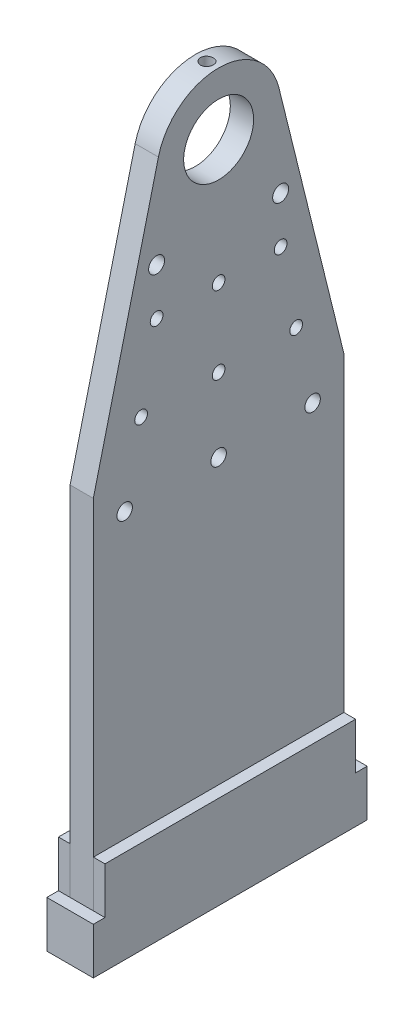
from build123d import *

# Parameters (mm, degrees)
SKETCH2_R               = 14.3129
SKETCH2_R_2             = 3.175
SKETCH2_R_3             = 2.6035
SKETCH2_R_4             = 3.2639
BOSS_EXTRUDE1_DEPTH     = 9.525
CHAMFER1_SIZE           = 4.7625
SKETCH3_R               = 2.6035
CUT_EXTRUDE1_DEPTH      = 25.4
CUT_EXTRUDE2_REACH      = 290.278
CUT_EXTRUDE2_END_RADIUS = 14.3129
SKETCH4_R               = 2.6035
SKETCH5_W               = 19.05
SKETCH5_H               = 112.128301604
SKETCH5_R               = 2.6035
BOSS_EXTRUDE2_DEPTH     = 12.7
SKETCH5_3_W             = 4.7625
SKETCH5_3_H             = 102.603301604
BOSS_EXTRUDE3_DEPTH     = 25.4
SKETCH5_4_W             = 19.05
SKETCH5_4_H             = 4.7625
BOSS_EXTRUDE4_DEPTH     = 6.35


with BuildPart() as part:
    # Sketch2 → Boss-Extrude1 (new body)
    with BuildSketch(Plane(origin=(-47.625, 0, 0), x_dir=(0, 0, -1), z_dir=(1, 0, 0))):
        with BuildLine():
            Line((51.301650802, 73.15), (51.301650802, 85.85))
            Line((51.301650802, 85.85), (24.65662816, 193.550056376))
            ThreePointArc((24.65662816, 193.550056376), (0, 212.85), (-24.65662816, 193.550056376))
            Line((-24.65662816, 193.550056376), (-51.301650802, 85.85))
            Line((-51.301650802, 85.85), (-51.301650802, 73.15))
            Line((-51.301650802, 73.15), (-51.301650802, -66.8))
            Line((-51.301650802, -66.8), (51.301650802, -66.8))
            Line((51.301650802, -66.8), (51.301650802, 73.15))
        make_face()
        with Locations((0, 187.45)):
            Circle(SKETCH2_R, mode=Mode.SUBTRACT)
        with Locations((38.476238101, 74.7375)):
            Circle(SKETCH2_R_2, mode=Mode.SUBTRACT)
        with Locations((0, 74.7375)):
            Circle(SKETCH2_R_2, mode=Mode.SUBTRACT)
        with Locations((-38.476238101, 74.7375)):
            Circle(SKETCH2_R_2, mode=Mode.SUBTRACT)
        with Locations((0, 136.65)):
            Circle(SKETCH2_R_3, mode=Mode.SUBTRACT)
        with Locations((-25.4, 136.65)):
            Circle(SKETCH2_R_3, mode=Mode.SUBTRACT)
        with Locations((-31.75, 104.9)):
            Circle(SKETCH2_R_3, mode=Mode.SUBTRACT)
        with Locations((0, 104.9)):
            Circle(SKETCH2_R_3, mode=Mode.SUBTRACT)
        with Locations((31.75, 104.9)):
            Circle(SKETCH2_R_3, mode=Mode.SUBTRACT)
        with Locations((25.4, 136.65)):
            Circle(SKETCH2_R_3, mode=Mode.SUBTRACT)
        with Locations((-25.4, 155.7)):
            Circle(SKETCH2_R_4, mode=Mode.SUBTRACT)
        with Locations((25.4, 155.7)):
            Circle(SKETCH2_R_4, mode=Mode.SUBTRACT)
    extrude(amount=BOSS_EXTRUDE1_DEPTH)

    # Chamfer1
    chamfer1_edges = [part.edges().sort_by_distance(p)[0] for p in [
        (-47.625, 74.7375, 3.175),
        (-47.625, 74.7375, -35.301238101),
        (-47.625, 74.7375, 41.651238101),
    ]]
    chamfer(chamfer1_edges, length=CHAMFER1_SIZE)

    # Sketch3 → Cut-Extrude1 (cut)
    with BuildSketch(Plane.XZ.offset(66.8)):
        with Locations((-42.8625, -38.476238101)):
            Circle(SKETCH3_R)
        with Locations((-42.8625, 0)):
            Circle(SKETCH3_R)
        with Locations((-42.8625, 38.476238101)):
            Circle(SKETCH3_R)
    extrude(amount=-CUT_EXTRUDE1_DEPTH, mode=Mode.SUBTRACT)

    # Cut-Extrude2: up to this cylinder (the profile starts outside it)
    cut_extrude2_end = Plane(origin=(-42.8625, 187.45, 0), z_dir=(-1, 0, 0)) * Cylinder(CUT_EXTRUDE2_END_RADIUS, 610.1818, mode=Mode.PRIVATE)
    # Sketch4 → Cut-Extrude2 (cut, up to the surface)
    with BuildSketch(Plane(origin=(0, 212.85, 0), x_dir=(-1, 0, 0), z_dir=(0, 1, 0)), mode=Mode.PRIVATE) as cut_extrude2_sk1:
        with Locations((42.8625, 0)):
            Circle(SKETCH4_R)
    cut_extrude2_tool1 = extrude(cut_extrude2_sk1.sketch, amount=-CUT_EXTRUDE2_REACH, mode=Mode.PRIVATE) - cut_extrude2_end
    add(cut_extrude2_tool1.solids().sort_by_distance((-42.8625, 212.85, 0))[0], mode=Mode.SUBTRACT)


with BuildPart() as body_2:
    # Sketch5 → Boss-Extrude2 (new body)
    with BuildSketch(Plane.XZ.offset(66.8)):
        with Locations((-42.8625, 0)):
            Rectangle(SKETCH5_W, SKETCH5_H)
        with Locations((-42.8625, 38.476238101)):
            Circle(SKETCH5_R, mode=Mode.SUBTRACT)
        with Locations((-42.8625, -38.476238101)):
            Circle(SKETCH5_R, mode=Mode.SUBTRACT)
        with Locations((-42.8625, 0)):
            Circle(SKETCH5_R, mode=Mode.SUBTRACT)
    extrude(amount=BOSS_EXTRUDE2_DEPTH)

    # Sketch5<3> → Boss-Extrude3 (add)
    with BuildSketch(Plane.XZ.offset(66.8)):
        with Locations((-35.71875, 0)):
            Rectangle(SKETCH5_3_W, SKETCH5_3_H)
        with Locations((-50.00625, 0)):
            Rectangle(SKETCH5_3_W, SKETCH5_3_H)
    extrude(amount=-BOSS_EXTRUDE3_DEPTH)

    # Sketch5<4> → Boss-Extrude4 (add)
    with BuildSketch(Plane.XZ.offset(66.8)):
        with Locations((-42.8625, 53.682900802)):
            Rectangle(SKETCH5_4_W, SKETCH5_4_H)
        with Locations((-42.8625, -53.682900802)):
            Rectangle(SKETCH5_4_W, SKETCH5_4_H)
    extrude(amount=-BOSS_EXTRUDE4_DEPTH)


solid = Compound([part.part, body_2.part])
